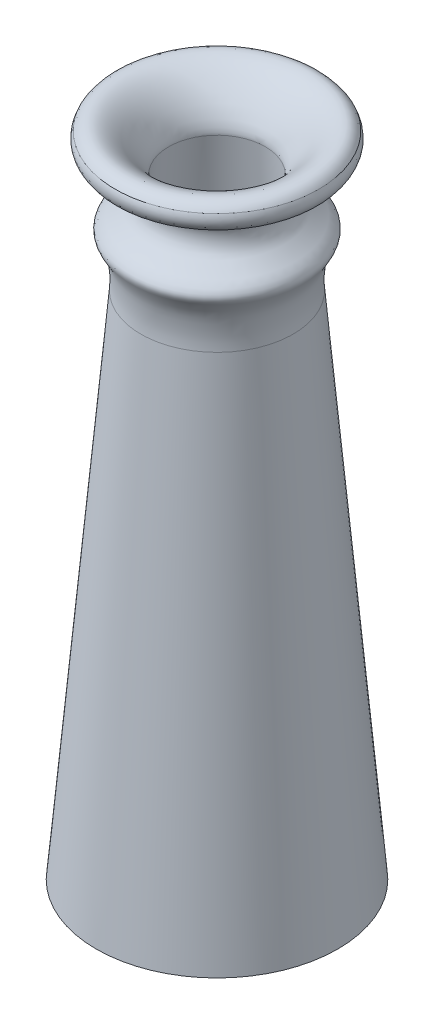
from build123d import *


with BuildPart() as part:
    # Sketch1 → Revolve1 (revolve)
    with BuildSketch(Plane.XY, mode=Mode.PRIVATE) as revolve1_sk:
        with BuildLine():
            Line((-26.665, 0), (-12.666813836, 160))
            add(Edge.make_bspline(
                [(-12.666813836, 160), (-12.306063793, 164.123391853), (-22.593841128, 176.138404535), (-26.666813836, 170)],
                knots=[0, 0, 0, 0, 1, 1, 1, 1], degree=3))
            add(Edge.make_bspline(
                [(-26.666813836, 170), (-27.754385906, 167.821657289), (-26.181066368, 165.941771752)],
                knots=[0, 0, 0, 1, 1, 1], degree=2))
            Line((-26.181066368, 165.941771752), (-17.959328183, 161.10645018))
            add(Edge.make_bspline(
                [(-17.959328183, 161.10645018), (-15.294831649, 159.923164093), (-15.474513264, 153.742286346), (-20.41748834, 151.432742663), (-23.752458344, 147.815263671), (-20.548654977, 143.94239304), (-19.886137527, 138.797475761), (-19.766435284, 136.001217037), (-19.962779385, 133.756993686)],
                knots=[0, 0, 0, 0, 0.247129658, 0.423699063, 0.532203519, 0.643266944, 0.840064638, 1, 1, 1, 1], degree=3))
            Line((-19.962779385, 133.756993686), (-31.665, 0))
            Line((-31.665, 0), (-26.665, 0))
        make_face()
    revolve(revolve1_sk.sketch.rotate(Axis((0, 0, 0), (0, 1, 0)), 270), axis=Axis((0, 0, 0), (0, 1, 0)))


solid = part.part
